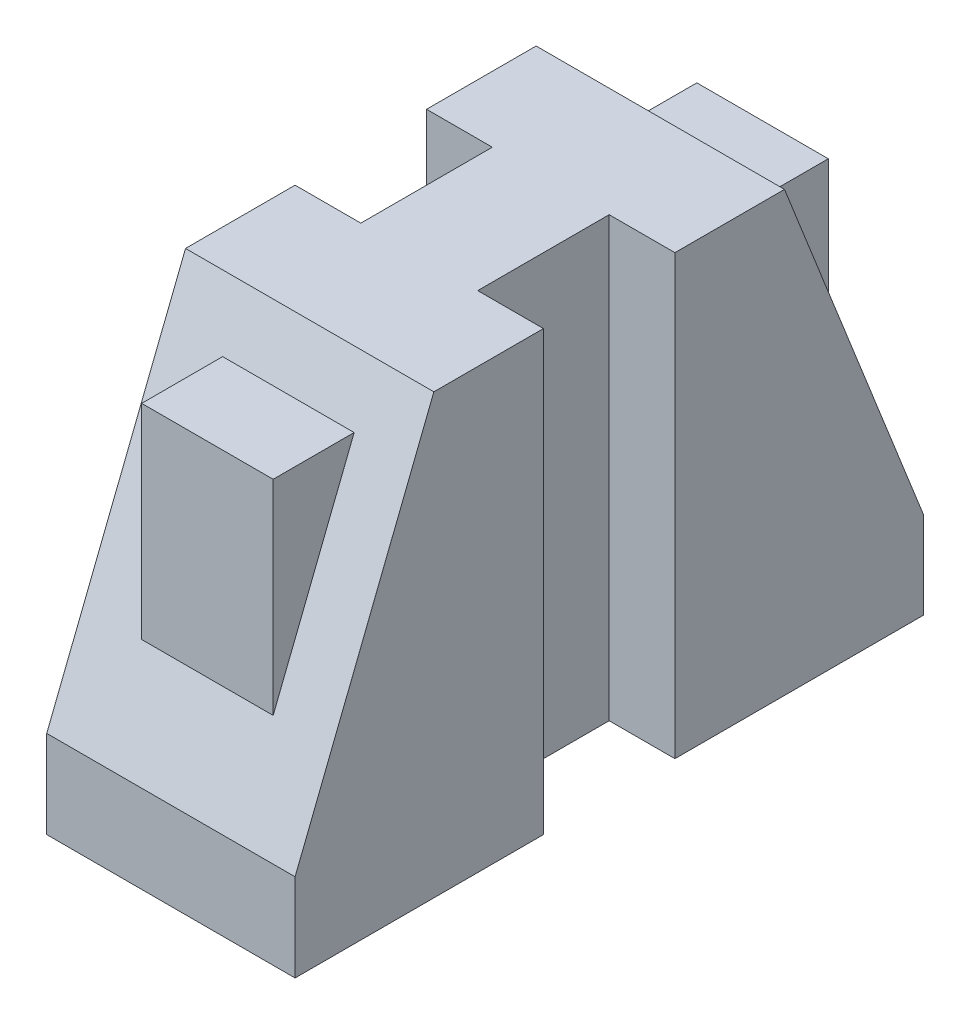
from build123d import *

# Parameters (mm, degrees)
SALIENTE_EXTRUIR2_DEPTH = 17
CROQUIS3_W              = 9
CROQUIS3_H              = 18
CORTAR_EXTRUIR2_DEPTH   = 76.749587458
SALIENTE_EXTRUIR4_DEPTH = 9


with BuildPart() as part:
    # Croquis1 → Saliente-Extruir2 (new, symmetric)
    with BuildSketch(Plane(origin=(0, 0, 0), x_dir=(0, 0, -1), z_dir=(1, 0, 0))):
        Polygon((43, -12), (-43, -12), (-43, 0), (-24, 48), (24, 48), (43, 0), align=None)
    extrude(amount=SALIENTE_EXTRUIR2_DEPTH, both=True)

    # Croquis3 → Cortar-Extruir2 (cut, through all)
    with BuildSketch(Plane(origin=(0, 48, 0), x_dir=(1, 0, 0), z_dir=(0, 1, 0))):
        with Locations((-12.5, 0)):
            Rectangle(CROQUIS3_W, CROQUIS3_H)
        with Locations((12.5, 0)):
            Rectangle(CROQUIS3_W, CROQUIS3_H)
    extrude(amount=-CORTAR_EXTRUIR2_DEPTH, mode=Mode.SUBTRACT)

    # Croquis4 → Saliente-Extruir4 (add, symmetric)
    with BuildSketch(Plane(origin=(0, 0, 0), x_dir=(0, 0, -1), z_dir=(1, 0, 0))):
        Polygon((-38, 12.631578947), (-38, 40.631578947), (-26.916666667, 40.631578947), align=None)
        Polygon((38, 12.631578947), (38, 40.631578947), (26.916666667, 40.631578947), align=None)
    extrude(amount=SALIENTE_EXTRUIR4_DEPTH, both=True)


solid = part.part
